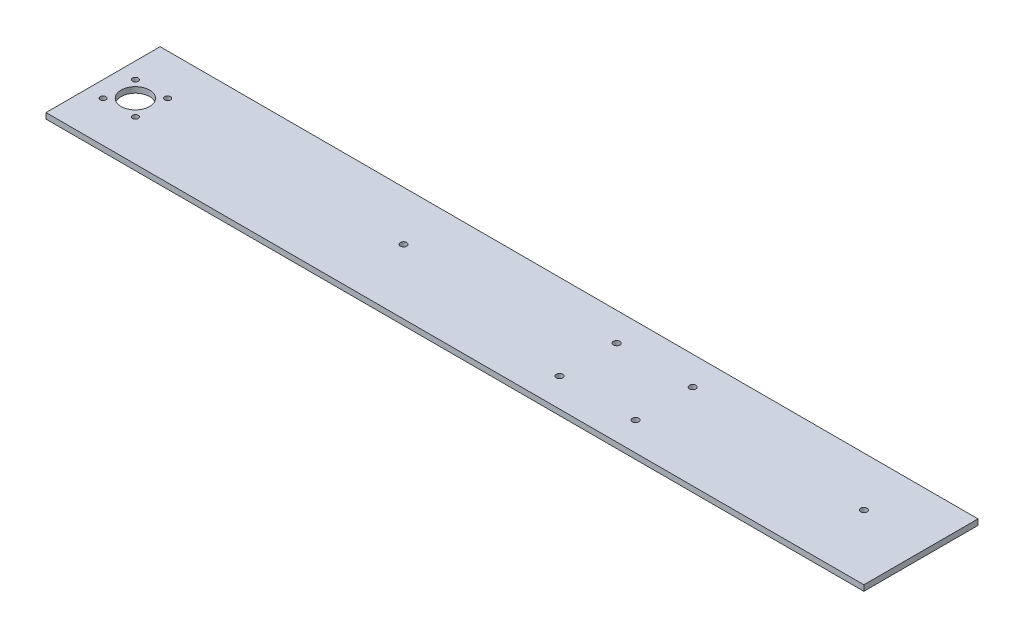
from build123d import *

# Parameters (mm, degrees)
SKETCH1_W                 = 430
SKETCH1_H                 = 60
BOSS_EXTRUDE1_DEPTH       = 3
OTW_R_POD_RUB_M31_D       = 3.4
SKETCH4_R                 = 7.5
CUT_EXTRUDE1_DEPTH        = 5
F_3_0MM_DOWEL_HOLE1_D     = 3
F_3_0MM_DOWEL_HOLE1_DEPTH = 6
F_3_0MM_DOWEL_HOLE1_TIP   = 0.901290929


with BuildPart() as part:
    # Sketch1 → Boss-Extrude1 (new body)
    with BuildSketch(Plane(origin=(0, 0, 0), x_dir=(1, 0, 0), z_dir=(0, 1, 0))):
        with Locations((85, 30)):
            Rectangle(SKETCH1_W, SKETCH1_H)
    extrude(amount=BOSS_EXTRUDE1_DEPTH)

    # Otwór pod śrubę M31 (through all)
    with Locations(Plane(origin=(0, 3, 0), x_dir=(1, 0, 0), z_dir=(0, 1, 0))):
        with Locations((266, 34), (24, 34), (125, 15), (165, 15), (165, 45), (125, 45)):
            Hole(OTW_R_POD_RUB_M31_D / 2)

    # Sketch4 → Cut-Extrude1 (cut)
    with BuildSketch(Plane(origin=(0, 3, 0), x_dir=(1, 0, 0), z_dir=(0, 1, 0))):
        with Locations(Location((-113, 30, 0), (0, 0, 270))):
            Circle(SKETCH4_R)
    extrude(amount=-CUT_EXTRUDE1_DEPTH, mode=Mode.SUBTRACT)

    # Ø3.0mm Dowel Hole1
    with Locations(Plane(origin=(0, 3, 0), x_dir=(1, 0, 0), z_dir=(0, 1, 0))):
        with Locations((-104.514718626, 21.514718626), (-104.514718626, 38.485281374), (-121.485281374, 21.514718626), (-121.485281374, 38.485281374)):
            Hole(F_3_0MM_DOWEL_HOLE1_D / 2, depth=F_3_0MM_DOWEL_HOLE1_DEPTH)
            with Locations((0, 0, -(F_3_0MM_DOWEL_HOLE1_DEPTH + F_3_0MM_DOWEL_HOLE1_TIP / 2))):  # 118° drill point
                Cone(0, F_3_0MM_DOWEL_HOLE1_D / 2, F_3_0MM_DOWEL_HOLE1_TIP, mode=Mode.SUBTRACT)


solid = part.part
